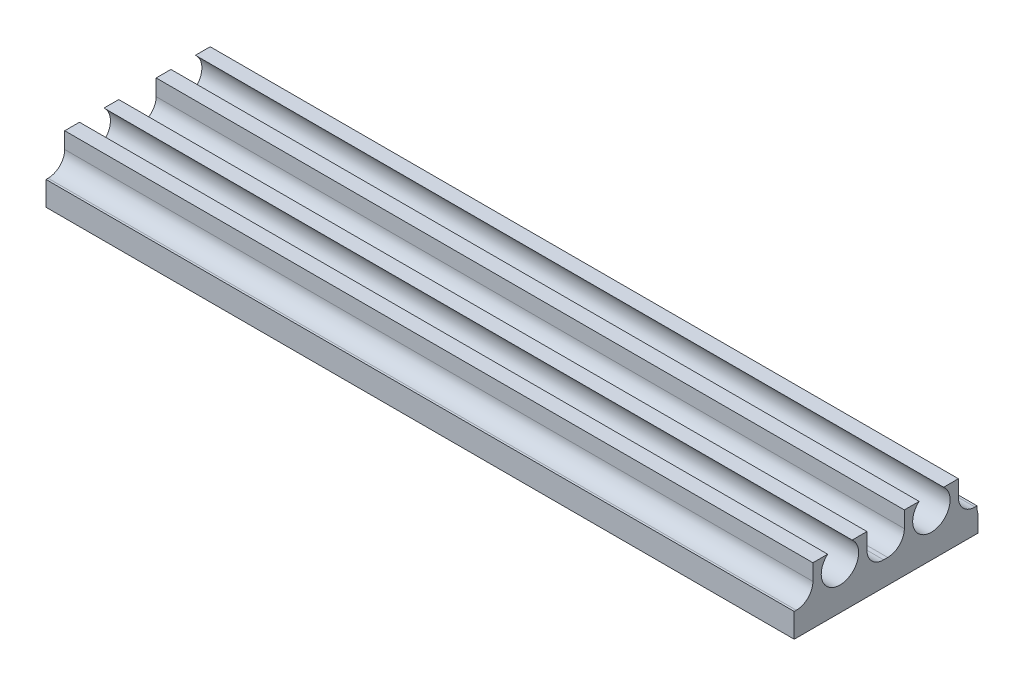
from build123d import *

# Parameters (mm, degrees)
EXTRUDE_1_DEPTH             = 90
SKETCH_2_W                  = 90
SKETCH_2_H                  = 17.75
EXTRUDE_2_DEPTH             = 8.2
SKETCH_3_W                  = 90
SKETCH_3_H                  = 50.95
EXTRUDE_3_DEPTH             = 8.2
SKETCH_4_W                  = 3.95
SKETCH_4_H                  = 29.5
CUT_EXTRUDE_1_DEPTH         = 96.44153315
SKETCH_5_W                  = 3.95
SKETCH_5_H                  = 6.2
CUT_EXTRUDE_2_DEPTH         = 96.44153315
SKETCH_6_W                  = 2.25
SKETCH_6_H                  = 3.95
CUT_EXTRUDE_3_DEPTH         = 96.44153315
SKETCH_7_W                  = 4.5
SKETCH_7_H                  = 3.95
CUT_EXTRUDE_4_DEPTH         = 96.44153315
SKETCH_8_W                  = 2.25
SKETCH_8_H                  = 3.95
CUT_EXTRUDE_5_DEPTH         = 96.44153315
SKETCH_9_W                  = 3.95
SKETCH_9_H                  = 2.25
CUT_EXTRUDE_6_DEPTH         = 96.44153315
SKETCH_10_W                 = 20.2
SKETCH_10_H                 = 45.2
CUT_EXTRUDE_7_DEPTH         = 86
HOLE_WIZARD_2_5_2_5_1_D     = 2.5
HOLE_WIZARD_4_5_4_5_1_D     = 4.5
HOLE_WIZARD_8_3_8_3_1_D     = 8.3
HOLE_WIZARD_8_3_8_3_1_DEPTH = 3.2
FILLET_1_R                  = 2
FILLET_2_R                  = 2
EXTRUDE_START               = -90
SKETCH_17_R                 = 1.25
EXTRUDE_4_DEPTH             = 90
CUT_EXTRUDE_START           = -100
SKETCH_18_R                 = 4.15
CUT_EXTRUDE_8_DEPTH         = 100
CUT_EXTRUDE_9_DEPTH         = 130
SKETCH_20_W                 = 90
SKETCH_20_H                 = 22.108571968
EXTRUDE_5_DEPTH             = 2


with BuildPart() as part:
    # Эскиз1 → Бобышка-Вытянуть1 (new body)
    with BuildSketch(Plane(origin=(90, 0, 0), x_dir=(0, 0, -1), z_dir=(1, 0, 0))):
        with BuildLine():
            Line((6.75, -24.093761792), (6.75, 19.25))
            Line((6.75, 19.25), (-11.593761792, 19.25))
            ThreePointArc((-11.593761792, 19.25), (-15.325, 18), (-11.593761792, 16.75))
            Line((-11.593761792, 16.75), (-11, 16.75))
            Line((-11, 16.75), (-11, -16.75))
            Line((-11, -16.75), (-11.593761792, -16.75))
            ThreePointArc((-11.593761792, -16.75), (-15.325, -18), (-11.593761792, -19.25))
            Line((-11.593761792, -19.25), (-11, -19.25))
            Line((-11, -19.25), (-11, -23.5))
            Line((-11, -23.5), (-6.75, -23.5))
            Line((-6.75, -23.5), (-6.75, -24.093761792))
            ThreePointArc((-6.75, -24.093761792), (-5.5, -27.825), (-4.25, -24.093761792))
            Line((-4.25, -24.093761792), (-4.25, -23.5))
            Line((-4.25, -23.5), (4.25, -23.5))
            Line((4.25, -23.5), (4.25, -24.093761792))
            ThreePointArc((4.25, -24.093761792), (5.5, -27.825), (6.75, -24.093761792))
        make_face()
    extrude(amount=-EXTRUDE_1_DEPTH)

    # Эскиз2 → Бобышка-Вытянуть2 (add)
    with BuildSketch(Plane(origin=(0, 19.25, 0), x_dir=(-1, 0, 0), z_dir=(0, 1, 0))):
        with Locations((-45, 2.125)):
            Rectangle(SKETCH_2_W, SKETCH_2_H)
    extrude(amount=EXTRUDE_2_DEPTH)

    # Эскиз3 → Бобышка-Вытянуть3 (add)
    with BuildSketch(Plane(origin=(0, 0, -6.75), x_dir=(-1, 0, 0), z_dir=(0, 0, -1))):
        with Locations((-45, 1.975)):
            Rectangle(SKETCH_3_W, SKETCH_3_H)
    extrude(amount=EXTRUDE_3_DEPTH)

    # Эскиз4 → Вырез-Вытянуть1 (cut, through all)
    with BuildSketch(Plane.ZY):
        with Locations((-12.975, 0)):
            Rectangle(SKETCH_4_W, SKETCH_4_H)
    extrude(amount=-CUT_EXTRUDE_1_DEPTH, mode=Mode.SUBTRACT)

    # Эскиз5 → Вырез-Вытянуть2 (cut, through all)
    with BuildSketch(Plane.ZY):
        with Locations((-12.975, 24.35)):
            Rectangle(SKETCH_5_W, SKETCH_5_H)
    extrude(amount=-CUT_EXTRUDE_2_DEPTH, mode=Mode.SUBTRACT)

    # Эскиз6 → Вырез-Вытянуть3 (cut, through all)
    with BuildSketch(Plane.ZY):
        with Locations((-9.875, 25.475)):
            Rectangle(SKETCH_6_W, SKETCH_6_H)
    extrude(amount=-CUT_EXTRUDE_3_DEPTH, mode=Mode.SUBTRACT)

    # Эскиз7 → Вырез-Вытянуть4 (cut, through all)
    with BuildSketch(Plane.ZY):
        with Locations((0, 25.475)):
            Rectangle(SKETCH_7_W, SKETCH_7_H)
    extrude(amount=-CUT_EXTRUDE_4_DEPTH, mode=Mode.SUBTRACT)

    # Эскиз8 → Вырез-Вытянуть5 (cut, through all)
    with BuildSketch(Plane.ZY):
        with Locations((9.875, 25.475)):
            Rectangle(SKETCH_8_W, SKETCH_8_H)
    extrude(amount=-CUT_EXTRUDE_5_DEPTH, mode=Mode.SUBTRACT)

    # Эскиз9 → Вырез-Вытянуть6 (cut, through all)
    with BuildSketch(Plane.ZY):
        with Locations((-12.975, -22.375)):
            Rectangle(SKETCH_9_W, SKETCH_9_H)
    extrude(amount=-CUT_EXTRUDE_6_DEPTH, mode=Mode.SUBTRACT)

    # Эскиз10 → Вырез-Вытянуть7 (cut)
    with BuildSketch(Plane(origin=(90, 0, 0), x_dir=(0, 0, -1), z_dir=(1, 0, 0))):
        Rectangle(SKETCH_10_W, SKETCH_10_H)
    extrude(amount=-CUT_EXTRUDE_7_DEPTH, mode=Mode.SUBTRACT)

    # Диаметр отверстия Ø2.5 (2.5)1 (through all)
    with Locations(Plane(origin=(90, 0, 0), x_dir=(0, 0, -1), z_dir=(1, 0, 0))):
        with Locations((5.5, -25.75), (-13.25, -18), (-5.5, -25.75), (-13.25, 18)):
            Hole(HOLE_WIZARD_2_5_2_5_1_D / 2)

    # Диаметр отверстия Ø4.5 (4.5)1 (through all)
    with Locations(Plane.ZY):
        with Locations((-13.25, -18), (-13.25, 18), (-5.5, 25.75), (5.5, 25.75)):
            Hole(HOLE_WIZARD_4_5_4_5_1_D / 2)

    # Диаметр отверстия Ø8.3 (8.3)1
    with Locations(Plane.ZY):
        with Locations((0, 0)):
            Hole(HOLE_WIZARD_8_3_8_3_1_D / 2, depth=HOLE_WIZARD_8_3_8_3_1_DEPTH)

    # Скругление1
    fillet_1_edges = [part.edges().sort_by_distance(p)[0] for p in [
        (45, 23.5, 8.75),
    ]]
    fillet(fillet_1_edges, radius=FILLET_1_R)

    # Скругление2
    fillet_2_edges = [part.edges().sort_by_distance(p)[0] for p in [
        (45, 23.5, -8.75),
        (45, 23.5, 2.25),
        (45, 23.5, -2.25),
        (45, -21.25, -11),
        (4, 0, -10.1),
        (4, -22.6, 0),
        (4, 0, 10.1),
        (4, 22.6, 0),
        (45, 14.75, -11),
        (45, -14.75, -11),
        (45, 21.25, -11),
    ]]
    fillet(fillet_2_edges, radius=FILLET_2_R)

    # Эскиз17 → Бобышка-Вытянуть4 (add)
    with BuildSketch(Plane(origin=(90, 0, 0), x_dir=(0, 0, -1), z_dir=(1, 0, 0)).offset(EXTRUDE_START)):
        with Locations((5.5, -25.75)):
            Circle(SKETCH_17_R)
        with Locations((-5.5, -25.75)):
            Circle(SKETCH_17_R)
        with Locations((-13.25, -18)):
            Circle(SKETCH_17_R)
        with Locations((-13.25, 18)):
            Circle(SKETCH_17_R)
    extrude(amount=EXTRUDE_4_DEPTH)

    # Эскиз18 → Вырез-Вытянуть8 (cut)
    with BuildSketch(Plane.ZY.offset(CUT_EXTRUDE_START)):
        Circle(SKETCH_18_R)
    extrude(amount=CUT_EXTRUDE_8_DEPTH, mode=Mode.SUBTRACT)

    # Эскиз19 → Вырез-Вытянуть9 (cut)
    with BuildSketch(Plane(origin=(90, 0, 0), x_dir=(0, 0, -1), z_dir=(1, 0, 0))):
        Polygon((10.1, 22.6), (-10.1, 22.6), (-23.41122638, 22.6), (-23.41122638, -34.175581762), (22.796675715, -34.175581762), (22.796675715, 22.6), align=None)
    extrude(amount=-CUT_EXTRUDE_9_DEPTH, mode=Mode.SUBTRACT)

    # Эскиз20 → Бобышка-Вытянуть5 (add)
    with BuildSketch(Plane.XZ.offset(-22.6)):
        with Locations((45, -0.054285984)):
            Rectangle(SKETCH_20_W, SKETCH_20_H)
    extrude(amount=EXTRUDE_5_DEPTH)


solid = part.part
